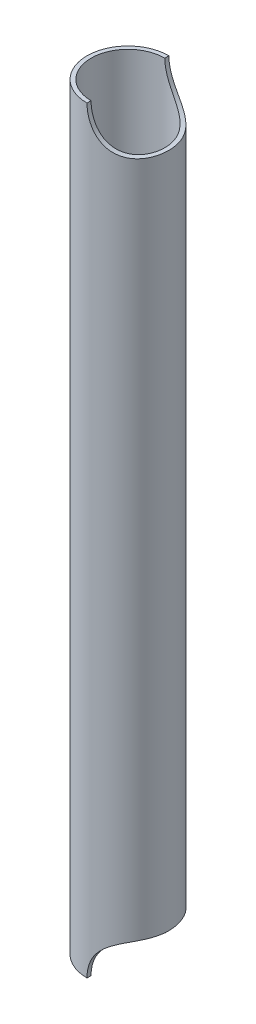
from build123d import *

# Parameters (mm, degrees)
SKETCH1_R           = 20
SKETCH1_R_2         = 18
BOSS_EXTRUDE1_DEPTH = 370
CUT_EXTRUDE1_DEPTH  = 25


with BuildPart() as part:
    # Sketch1 → Boss-Extrude1 (new body)
    with BuildSketch(Plane(origin=(0, 0, 0), x_dir=(1, 0, 0), z_dir=(0, 1, 0))):
        with Locations(Location((0, 0, 0), (0, 0, 270))):
            Circle(SKETCH1_R)
        with Locations(Location((0, 0, 0), (0, 0, 270))):
            Circle(SKETCH1_R_2, mode=Mode.SUBTRACT)
    extrude(amount=BOSS_EXTRUDE1_DEPTH)

    # Sketch2 → Cut-Extrude1 (cut, symmetric)
    with BuildSketch(Plane.XY):
        with BuildLine():
            ThreePointArc((0, 0), (5.857864376, 14.142135624), (20, 20))
            Line((20, 20), (20, 0))
            Line((20, 0), (0, 0))
        make_face()
        with BuildLine():
            ThreePointArc((0, 370), (5.857864376, 355.857864376), (20, 350))
            Line((20, 350), (20, 370))
            Line((20, 370), (0, 370))
        make_face()
    extrude(amount=CUT_EXTRUDE1_DEPTH, both=True, mode=Mode.SUBTRACT)


solid = part.part
